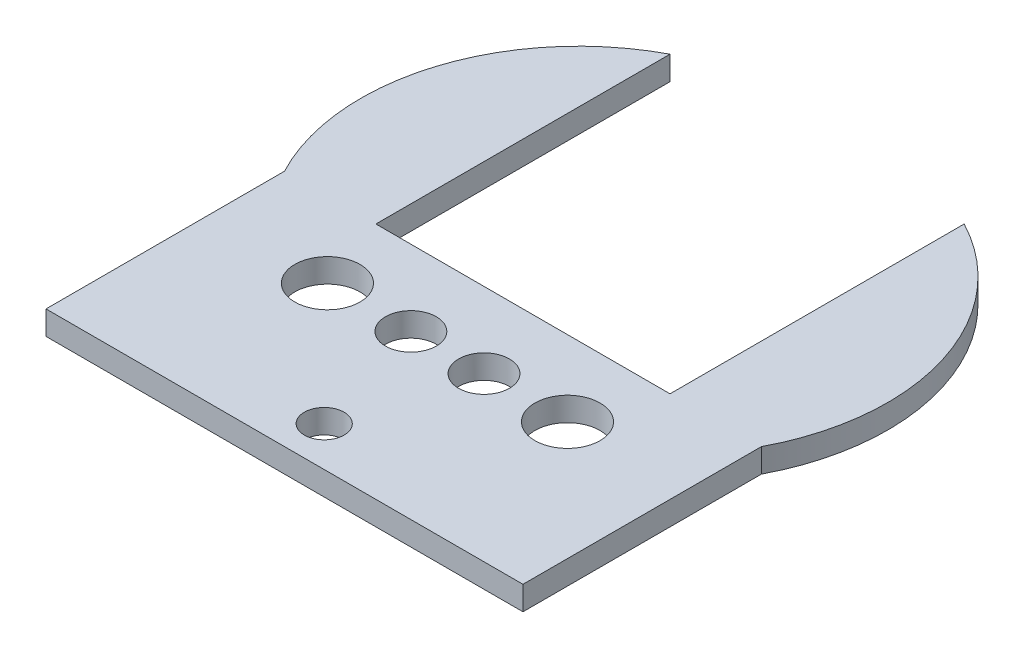
from build123d import *

# Parameters (mm, degrees)
BOSS_EXTRUDE1_DEPTH = 3
SKETCH2_R           = 2.5
CUT_EXTRUDE1_DEPTH  = 20
SKETCH3_W           = 5
SKETCH3_H           = 5
CUT_EXTRUDE2_DEPTH  = 10
SKETCH4_R           = 4.1
CUT_EXTRUDE3_DEPTH  = 10
SKETCH5_R           = 3.2
CUT_EXTRUDE4_DEPTH  = 10


with BuildPart() as part:
    # Sketch1 → Boss-Extrude1 (new body)
    with BuildSketch(Plane(origin=(0, 0, 0), x_dir=(1, 0, 0), z_dir=(0, 1, 0))):
        with BuildLine():
            Line((-19.801702617, 0), (17.198297383, 0))
            Line((17.198297383, 0), (17.198297383, 37))
            ThreePointArc((17.198297383, 37), (30.611248287, 20.881727984), (28.698297383, 0))
            Line((28.698297383, 0), (28.698297383, -30))
            Line((28.698297383, -30), (-31.301702617, -30))
            Line((-31.301702617, -30), (-31.301702617, 0))
            ThreePointArc((-31.301702617, 0), (-33.214653521, 20.881727984), (-19.801702617, 37))
            Line((-19.801702617, 37), (-19.801702617, 0))
        make_face()
    extrude(amount=BOSS_EXTRUDE1_DEPTH)

    # Sketch2 → Cut-Extrude1 (cut)
    with BuildSketch(Plane(origin=(0, 3, 0), x_dir=(1, 0, 0), z_dir=(0, 1, 0))):
        with Locations(Location((-1.301702617, -25, 0), (0, 0, 270))):
            Circle(SKETCH2_R)
    extrude(amount=-CUT_EXTRUDE1_DEPTH, mode=Mode.SUBTRACT)

    # Sketch3 → Cut-Extrude2 (cut)
    with BuildSketch(Plane.XZ):
        with Locations((13.798297383, 9.5)):
            Rectangle(SKETCH3_W, SKETCH3_H)
        with Locations((-16.401702617, 9.5)):
            Rectangle(SKETCH3_W, SKETCH3_H)
    extrude(amount=-CUT_EXTRUDE2_DEPTH, mode=Mode.SUBTRACT)

    # Sketch4 → Cut-Extrude3 (cut)
    with BuildSketch(Plane.XZ):
        with Locations(Location((13.798297383, 9.5, 0), (0, 0, 270))):
            Circle(SKETCH4_R)
        with Locations(Location((-16.401702617, 9.5, 0), (0, 0, 90))):
            Circle(SKETCH4_R)
    extrude(amount=-CUT_EXTRUDE3_DEPTH, mode=Mode.SUBTRACT)

    # Sketch5 → Cut-Extrude4 (cut)
    with BuildSketch(Plane(origin=(0, 3, 0), x_dir=(1, 0, 0), z_dir=(0, 1, 0))):
        with Locations(Location((-5.901702617, -9.5, 0), (0, 0, 270))):
            Circle(SKETCH5_R)
        with Locations(Location((3.298297383, -9.5, 0), (0, 0, 270))):
            Circle(SKETCH5_R)
    extrude(amount=-CUT_EXTRUDE4_DEPTH, mode=Mode.SUBTRACT)


solid = part.part
